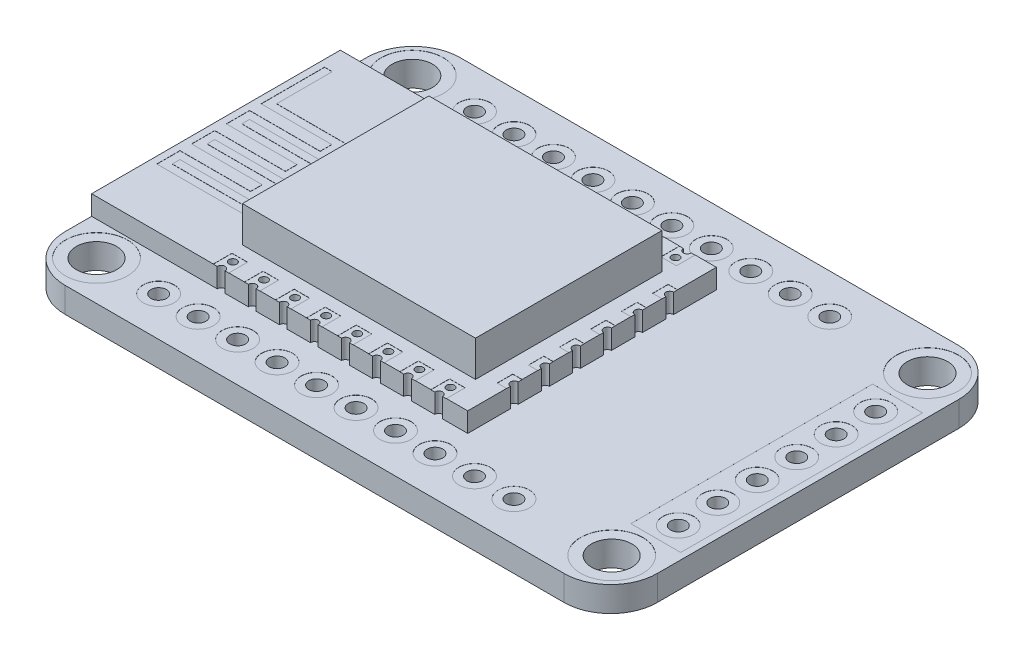
from build123d import *

# Parameters (mm, degrees)
SKETCH1_W           = 38.1
SKETCH1_H           = 25.4
BOSS_EXTRUDE1_DEPTH = 1.62
FILLET1_R           = 3
SKETCH2_R           = 1.3
CUT_EXTRUDE1_DEPTH  = 23.952492239
SKETCH4_R           = 2
CUT_EXTRUDE2_DEPTH  = 0.01
SKETCH3_R           = 0.5
CUT_EXTRUDE3_DEPTH  = 23.952492239
SKETCH6_R           = 1
CUT_EXTRUDE4_DEPTH  = 0.01
SKETCH7_W           = 24.2
SKETCH7_H           = 16
BOSS_EXTRUDE2_DEPTH = 1.26
SKETCH8_W           = 15
SKETCH8_H           = 12
BOSS_EXTRUDE3_DEPTH = 2.3
SKETCH9_R           = 0.25
CUT_EXTRUDE5_DEPTH  = 1.26
SKETCH10_W          = 1
SKETCH10_H          = 1.2
SKETCH10_W_2        = 0.6
SKETCH10_H_2        = 1
CUT_EXTRUDE6_DEPTH  = 0.01
SKETCH11_W          = 3.211059836
SKETCH11_H          = 15.558349442
CUT_EXTRUDE8_DEPTH  = 0.001


with BuildPart() as part:
    # Sketch1 → Boss-Extrude1 (new body)
    with BuildSketch(Plane(origin=(0, 0, 0), x_dir=(1, 0, 0), z_dir=(0, 1, 0))):
        Rectangle(SKETCH1_W, SKETCH1_H)
    extrude(amount=BOSS_EXTRUDE1_DEPTH)

    # Fillet1
    fillet1_edges = [part.edges().sort_by_distance(p)[0] for p in [
        (19.05, 0.81, 12.7),
        (-19.05, 0.81, 12.7),
        (-19.05, 0.81, -12.7),
        (19.05, 0.81, -12.7),
    ]]
    fillet(fillet1_edges, radius=FILLET1_R)

    # Sketch2 → Cut-Extrude1 (cut, through all)
    with BuildSketch(Plane(origin=(0, 1.62, 0), x_dir=(1, 0, 0), z_dir=(0, 1, 0))):
        with Locations(Location((-16.575, 10.16, 0), (0, 0, 270))):
            Circle(SKETCH2_R)
        with Locations(Location((16.575, 10.16, 0), (0, 0, 90))):
            Circle(SKETCH2_R)
        with Locations(Location((16.575, -10.16, 0), (0, 0, 270))):
            Circle(SKETCH2_R)
        with Locations(Location((-16.575, -10.16, 0), (0, 0, 90))):
            Circle(SKETCH2_R)
    extrude(amount=-CUT_EXTRUDE1_DEPTH, mode=Mode.SUBTRACT)

    # Sketch4 → Cut-Extrude2 (cut)
    with BuildSketch(Plane(origin=(0, 1.62, 0), x_dir=(1, 0, 0), z_dir=(0, 1, 0))):
        with Locations(Location((16.575, 10.16, 0), (0, 0, 270))):
            Circle(SKETCH4_R)
        with Locations(Location((-16.575, 10.16, 0), (0, 0, 270))):
            Circle(SKETCH4_R)
        with Locations(Location((16.575, -10.16, 0), (0, 0, 270))):
            Circle(SKETCH4_R)
        with Locations(Location((-16.575, -10.16, 0), (0, 0, 270))):
            Circle(SKETCH4_R)
    extrude(amount=-CUT_EXTRUDE2_DEPTH, mode=Mode.SUBTRACT)

    # Sketch3 → Cut-Extrude3 (cut, through all)
    with BuildSketch(Plane(origin=(0, 1.62, 0), x_dir=(1, 0, 0), z_dir=(0, 1, 0))):
        with Locations(Location((-12.575, 10.16, 0), (0, 0, 270))):
            Circle(SKETCH3_R)
        with Locations(Location((-10.035, 10.16, 0), (0, 0, 270))):
            Circle(SKETCH3_R)
        with Locations(Location((-7.495, 10.16, 0), (0, 0, 270))):
            Circle(SKETCH3_R)
        with Locations(Location((-4.955, 10.16, 0), (0, 0, 270))):
            Circle(SKETCH3_R)
        with Locations(Location((-2.415, 10.16, 0), (0, 0, 270))):
            Circle(SKETCH3_R)
        with Locations(Location((0.125, 10.16, 0), (0, 0, 270))):
            Circle(SKETCH3_R)
        with Locations(Location((2.665, 10.16, 0), (0, 0, 270))):
            Circle(SKETCH3_R)
        with Locations(Location((5.205, 10.16, 0), (0, 0, 270))):
            Circle(SKETCH3_R)
        with Locations(Location((7.745, 10.16, 0), (0, 0, 270))):
            Circle(SKETCH3_R)
        with Locations(Location((10.285, 10.16, 0), (0, 0, 270))):
            Circle(SKETCH3_R)
        with Locations(Location((10.285, -10.16, 0), (0, 0, 90))):
            Circle(SKETCH3_R)
        with Locations(Location((7.745, -10.16, 0), (0, 0, 90))):
            Circle(SKETCH3_R)
        with Locations(Location((5.205, -10.16, 0), (0, 0, 90))):
            Circle(SKETCH3_R)
        with Locations(Location((2.665, -10.16, 0), (0, 0, 90))):
            Circle(SKETCH3_R)
        with Locations(Location((0.125, -10.16, 0), (0, 0, 90))):
            Circle(SKETCH3_R)
        with Locations(Location((-2.415, -10.16, 0), (0, 0, 90))):
            Circle(SKETCH3_R)
        with Locations(Location((-4.955, -10.16, 0), (0, 0, 90))):
            Circle(SKETCH3_R)
        with Locations(Location((-7.495, -10.16, 0), (0, 0, 90))):
            Circle(SKETCH3_R)
        with Locations(Location((-10.035, -10.16, 0), (0, 0, 90))):
            Circle(SKETCH3_R)
        with Locations(Location((-12.575, -10.16, 0), (0, 0, 90))):
            Circle(SKETCH3_R)
        with Locations(Location((17.05, 6.35, 0), (0, 0, 270))):
            Circle(SKETCH3_R)
        with Locations(Location((17.05, 3.81, 0), (0, 0, 270))):
            Circle(SKETCH3_R)
        with Locations(Location((17.05, 1.27, 0), (0, 0, 270))):
            Circle(SKETCH3_R)
        with Locations(Location((17.05, -1.27, 0), (0, 0, 270))):
            Circle(SKETCH3_R)
        with Locations(Location((17.05, -3.81, 0), (0, 0, 270))):
            Circle(SKETCH3_R)
        with Locations(Location((17.05, -6.35, 0), (0, 0, 270))):
            Circle(SKETCH3_R)
    extrude(amount=-CUT_EXTRUDE3_DEPTH, mode=Mode.SUBTRACT)

    # Sketch6 → Cut-Extrude4 (cut)
    with BuildSketch(Plane(origin=(0, 1.62, 0), x_dir=(1, 0, 0), z_dir=(0, 1, 0))):
        with Locations(Location((2.665, 10.16, 0), (0, 0, 270))):
            Circle(SKETCH6_R)
        with Locations(Location((0.125, 10.16, 0), (0, 0, 270))):
            Circle(SKETCH6_R)
        with Locations(Location((-2.415, 10.16, 0), (0, 0, 270))):
            Circle(SKETCH6_R)
        with Locations(Location((-4.955, 10.16, 0), (0, 0, 270))):
            Circle(SKETCH6_R)
        with Locations(Location((-7.495, 10.16, 0), (0, 0, 270))):
            Circle(SKETCH6_R)
        with Locations(Location((-10.035, 10.16, 0), (0, 0, 270))):
            Circle(SKETCH6_R)
        with Locations(Location((-12.575, 10.16, 0), (0, 0, 270))):
            Circle(SKETCH6_R)
        with Locations(Location((5.205, -10.16, 0), (0, 0, 270))):
            Circle(SKETCH6_R)
        with Locations(Location((7.745, -10.16, 0), (0, 0, 270))):
            Circle(SKETCH6_R)
        with Locations(Location((10.285, -10.16, 0), (0, 0, 270))):
            Circle(SKETCH6_R)
        with Locations(Location((10.285, 10.16, 0), (0, 0, 270))):
            Circle(SKETCH6_R)
        with Locations(Location((7.745, 10.16, 0), (0, 0, 270))):
            Circle(SKETCH6_R)
        with Locations(Location((5.205, 10.16, 0), (0, 0, 270))):
            Circle(SKETCH6_R)
        with Locations(Location((-12.575, -10.16, 0), (0, 0, 270))):
            Circle(SKETCH6_R)
        with Locations(Location((-10.035, -10.16, 0), (0, 0, 270))):
            Circle(SKETCH6_R)
        with Locations(Location((-7.495, -10.16, 0), (0, 0, 270))):
            Circle(SKETCH6_R)
        with Locations(Location((-4.955, -10.16, 0), (0, 0, 270))):
            Circle(SKETCH6_R)
        with Locations(Location((-2.415, -10.16, 0), (0, 0, 270))):
            Circle(SKETCH6_R)
        with Locations(Location((0.125, -10.16, 0), (0, 0, 270))):
            Circle(SKETCH6_R)
        with Locations(Location((2.665, -10.16, 0), (0, 0, 270))):
            Circle(SKETCH6_R)
        with Locations(Location((17.05, -3.81, 0), (0, 0, 270))):
            Circle(SKETCH6_R)
        with Locations(Location((17.05, -1.27, 0), (0, 0, 270))):
            Circle(SKETCH6_R)
        with Locations(Location((17.05, 1.27, 0), (0, 0, 270))):
            Circle(SKETCH6_R)
        with Locations(Location((17.05, 3.81, 0), (0, 0, 270))):
            Circle(SKETCH6_R)
        with Locations(Location((17.05, 6.35, 0), (0, 0, 270))):
            Circle(SKETCH6_R)
        with Locations(Location((17.05, -6.35, 0), (0, 0, 270))):
            Circle(SKETCH6_R)
    extrude(amount=-CUT_EXTRUDE4_DEPTH, mode=Mode.SUBTRACT)

    # Sketch7 → Boss-Extrude2 (add)
    with BuildSketch(Plane(origin=(0, 1.62, 0), x_dir=(1, 0, 0), z_dir=(0, 1, 0))):
        with Locations((-6.95, 0)):
            Rectangle(SKETCH7_W, SKETCH7_H)
    extrude(amount=BOSS_EXTRUDE2_DEPTH)

    # Sketch8 → Boss-Extrude3 (add)
    with BuildSketch(Plane(origin=(0, 2.88, 0), x_dir=(1, 0, 0), z_dir=(0, 1, 0))):
        with Locations((-3.85, 0)):
            Rectangle(SKETCH8_W, SKETCH8_H)
    extrude(amount=BOSS_EXTRUDE3_DEPTH)

    # Sketch9 → Cut-Extrude5 (cut)
    with BuildSketch(Plane(origin=(0, 2.88, 0), x_dir=(1, 0, 0), z_dir=(0, 1, 0))):
        with Locations(Location((-10.718623859, 7.241193887, 0), (0, 0, 270))):
            Circle(SKETCH9_R)
        with Locations(Location((-8.718623859, 7.241193887, 0), (0, 0, 270))):
            Circle(SKETCH9_R)
        with Locations(Location((-6.718623859, 7.241193887, 0), (0, 0, 270))):
            Circle(SKETCH9_R)
        with Locations(Location((-4.718623859, 7.241193887, 0), (0, 0, 270))):
            Circle(SKETCH9_R)
        with Locations(Location((-2.718623859, 7.241193887, 0), (0, 0, 270))):
            Circle(SKETCH9_R)
        with Locations(Location((-0.718623859, 7.241193887, 0), (0, 0, 270))):
            Circle(SKETCH9_R)
        with Locations(Location((1.281376141, 7.241193887, 0), (0, 0, 270))):
            Circle(SKETCH9_R)
        with Locations(Location((3.281376141, 7.241193887, 0), (0, 0, 270))):
            Circle(SKETCH9_R)
        with Locations((-8.718623859, 7.991193887)):
            Circle(SKETCH9_R)
        with Locations((-6.718623859, 7.991193887)):
            Circle(SKETCH9_R)
        with Locations((-4.718623859, 7.991193887)):
            Circle(SKETCH9_R)
        with Locations((-2.718623859, 7.991193887)):
            Circle(SKETCH9_R)
        with Locations((-0.718623859, 7.991193887)):
            Circle(SKETCH9_R)
        with Locations((1.281376141, 7.991193887)):
            Circle(SKETCH9_R)
        with Locations((3.281376141, 7.991193887)):
            Circle(SKETCH9_R)
        with Locations((-10.718623859, 7.991193887)):
            Circle(SKETCH9_R)
        with Locations((-10.718623859, -7.991193887)):
            Circle(SKETCH9_R)
        with Locations((3.281376141, -7.991193887)):
            Circle(SKETCH9_R)
        with Locations((1.281376141, -7.991193887)):
            Circle(SKETCH9_R)
        with Locations((-0.718623859, -7.991193887)):
            Circle(SKETCH9_R)
        with Locations((-2.718623859, -7.991193887)):
            Circle(SKETCH9_R)
        with Locations((-4.718623859, -7.991193887)):
            Circle(SKETCH9_R)
        with Locations((-6.718623859, -7.991193887)):
            Circle(SKETCH9_R)
        with Locations((-8.718623859, -7.991193887)):
            Circle(SKETCH9_R)
        with Locations(Location((3.281376141, -7.241193887, 0), (0, 0, 90))):
            Circle(SKETCH9_R)
        with Locations(Location((1.281376141, -7.241193887, 0), (0, 0, 90))):
            Circle(SKETCH9_R)
        with Locations(Location((-0.718623859, -7.241193887, 0), (0, 0, 90))):
            Circle(SKETCH9_R)
        with Locations(Location((-2.718623859, -7.241193887, 0), (0, 0, 90))):
            Circle(SKETCH9_R)
        with Locations(Location((-4.718623859, -7.241193887, 0), (0, 0, 90))):
            Circle(SKETCH9_R)
        with Locations(Location((-6.718623859, -7.241193887, 0), (0, 0, 90))):
            Circle(SKETCH9_R)
        with Locations(Location((-8.718623859, -7.241193887, 0), (0, 0, 90))):
            Circle(SKETCH9_R)
        with Locations(Location((-10.718623859, -7.241193887, 0), (0, 0, 90))):
            Circle(SKETCH9_R)
        with Locations((5.15, 5)):
            Circle(SKETCH9_R)
        with Locations((5.15, 3)):
            Circle(SKETCH9_R)
        with Locations((5.15, 1)):
            Circle(SKETCH9_R)
        with Locations((5.15, -1)):
            Circle(SKETCH9_R)
        with Locations((5.15, -3)):
            Circle(SKETCH9_R)
        with Locations((5.15, -5)):
            Circle(SKETCH9_R)
    extrude(amount=-CUT_EXTRUDE5_DEPTH, mode=Mode.SUBTRACT)

    # Sketch10 → Cut-Extrude6 (cut)
    with BuildSketch(Plane(origin=(0, 2.88, 0), x_dir=(1, 0, 0), z_dir=(0, 1, 0))):
        with Locations((-10.718623859, 7.4)):
            Rectangle(SKETCH10_W, SKETCH10_H)
        with Locations((-8.718623859, 7.4)):
            Rectangle(SKETCH10_W, SKETCH10_H)
        with Locations((-6.718623859, 7.4)):
            Rectangle(SKETCH10_W, SKETCH10_H)
        with Locations((-4.718623859, 7.4)):
            Rectangle(SKETCH10_W, SKETCH10_H)
        with Locations((-2.718623859, 7.4)):
            Rectangle(SKETCH10_W, SKETCH10_H)
        with Locations((-0.718623859, 7.4)):
            Rectangle(SKETCH10_W, SKETCH10_H)
        with Locations((1.281376141, 7.4)):
            Rectangle(SKETCH10_W, SKETCH10_H)
        with Locations((3.281376141, 7.4)):
            Rectangle(SKETCH10_W, SKETCH10_H)
        with Locations((3.281376141, -7.4)):
            Rectangle(SKETCH10_W, SKETCH10_H)
        with Locations((1.281376141, -7.4)):
            Rectangle(SKETCH10_W, SKETCH10_H)
        with Locations((-0.718623859, -7.4)):
            Rectangle(SKETCH10_W, SKETCH10_H)
        with Locations((-2.718623859, -7.4)):
            Rectangle(SKETCH10_W, SKETCH10_H)
        with Locations((-4.718623859, -7.4)):
            Rectangle(SKETCH10_W, SKETCH10_H)
        with Locations((-6.718623859, -7.4)):
            Rectangle(SKETCH10_W, SKETCH10_H)
        with Locations((-8.718623859, -7.4)):
            Rectangle(SKETCH10_W, SKETCH10_H)
        with Locations((-10.718623859, -7.4)):
            Rectangle(SKETCH10_W, SKETCH10_H)
        with Locations((4.85, 5)):
            Rectangle(SKETCH10_W_2, SKETCH10_H_2)
        with Locations((4.85, 3)):
            Rectangle(SKETCH10_W_2, SKETCH10_H_2)
        with Locations((4.85, 1)):
            Rectangle(SKETCH10_W_2, SKETCH10_H_2)
        with Locations((4.85, -1)):
            Rectangle(SKETCH10_W_2, SKETCH10_H_2)
        with Locations((4.85, -3)):
            Rectangle(SKETCH10_W_2, SKETCH10_H_2)
        with Locations((4.85, -5)):
            Rectangle(SKETCH10_W_2, SKETCH10_H_2)
        Polygon((-18.608220194, 6.548473932), (-18.608220194, 2.46583574), (-14.065009718, 2.46583574), (-14.065009718, 1.721181756), (-18.608220194, 1.721181756), (-18.608220194, 0.228171299), (-14.065009718, 0.228171299), (-14.065009718, -0.516482684), (-18.608220194, -0.516482684), (-18.608220194, -2.009493142), (-14.065009718, -2.009493142), (-14.065009718, -2.754147125), (-18.608220194, -2.754147125), (-18.608220194, -4.247157583), (-11.848454591, -4.247157583), (-11.848454591, 2.46583574), (-12.348454591, 2.46583574), (-12.348454591, -3.747157583), (-18.108220194, -3.747157583), (-18.108220194, -3.254147125), (-13.565009718, -3.254147125), (-13.565009718, -1.509493142), (-18.108220194, -1.509493142), (-18.108220194, -1.016482684), (-13.565009718, -1.016482684), (-13.565009718, 0.728171299), (-18.108220194, 0.728171299), (-18.108220194, 1.221181756), (-13.565009718, 1.221181756), (-13.565009718, 2.96583574), (-18.108220194, 2.96583574), (-18.108220194, 6.548473932), align=None)
    extrude(amount=-CUT_EXTRUDE6_DEPTH, mode=Mode.SUBTRACT)

    # Sketch11 → Cut-Extrude8 (cut)
    with BuildSketch(Plane(origin=(0, 1.62, 0), x_dir=(1, 0, 0), z_dir=(0, 1, 0))):
        with Locations((17.0300852, 0)):
            Rectangle(SKETCH11_W, SKETCH11_H)
    extrude(amount=-CUT_EXTRUDE8_DEPTH, mode=Mode.SUBTRACT)


solid = part.part
